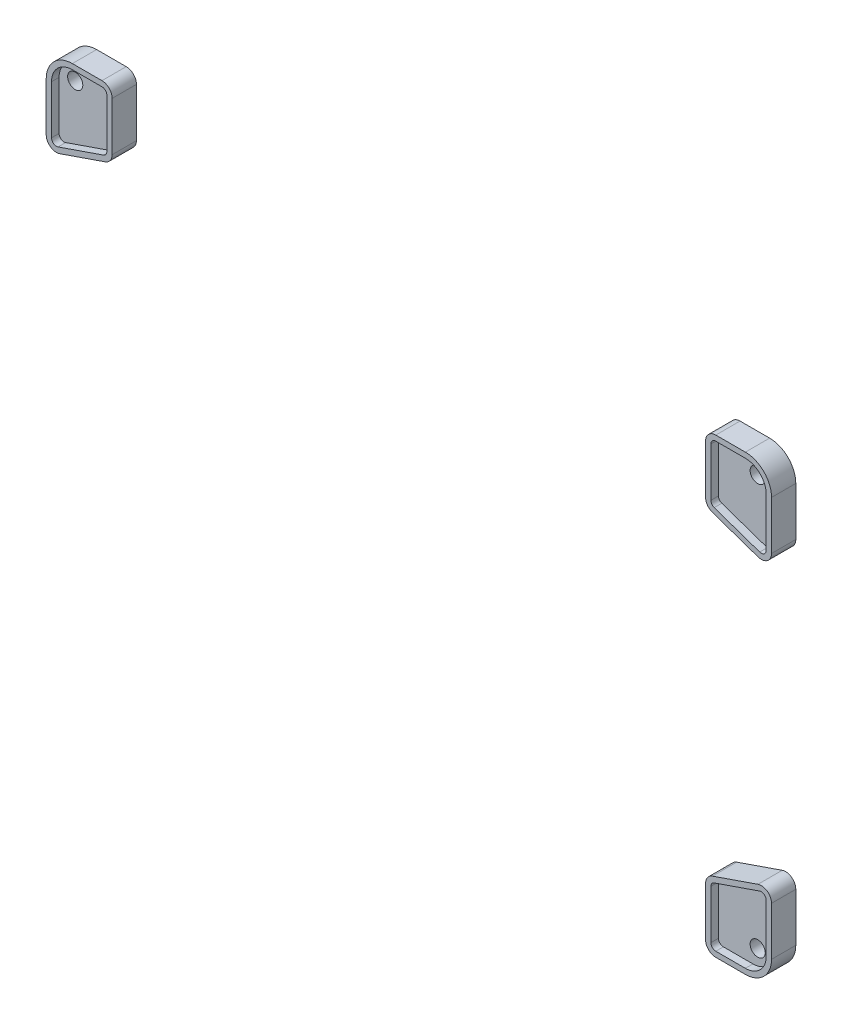
from build123d import *

# Parameters (mm, degrees)
BOSS_EXTRUDE1_DEPTH = 3.2
CUT_EXTRUDE1_DEPTH  = 1
SKETCH4_R           = 1
CUT_EXTRUDE2_DEPTH  = 57.453531776


with BuildPart() as part:
    # Sketch1 → Boss-Extrude1 (new body)
    with BuildSketch(Plane.XY):
        with BuildLine():
            Line((47.825, 19.975), (47.825, 26.375))
            ThreePointArc((47.825, 26.375), (46.814518395, 28.814518395), (44.375, 29.825))
            Line((44.375, 29.825), (40.475, 29.825))
            ThreePointArc((40.475, 29.825), (39.520405845, 29.429594155), (39.125, 28.475))
            Line((39.125, 28.475), (39.125, 22.044366415))
            ThreePointArc((39.125, 22.044366415), (39.375745502, 21.260695854), (40.034836368, 20.768139171))
            Line((40.034836368, 20.768139171), (46.034836368, 18.698772757))
            ThreePointArc((46.034836368, 18.698772757), (47.258670561, 18.875745502), (47.825, 19.975))
        make_face()
    extrude(amount=BOSS_EXTRUDE1_DEPTH)

    # Sketch2 → Cut-Extrude1 (cut)
    with BuildSketch(Plane.XY.offset(3.2)):
        with BuildLine():
            Line((40.263069362, 21.429886631), (46.263069362, 19.360520216))
            ThreePointArc((46.263069362, 19.360520216), (46.852322863, 19.445729316), (47.125, 19.975))
            Line((47.125, 19.975), (47.125, 26.375))
            ThreePointArc((47.125, 26.375), (46.319543648, 28.319543648), (44.375, 29.125))
            Line((44.375, 29.125), (40.475, 29.125))
            ThreePointArc((40.475, 29.125), (40.015380592, 28.934619408), (39.825, 28.475))
            Line((39.825, 28.475), (39.825, 22.044366415))
            ThreePointArc((39.825, 22.044366415), (39.945729316, 21.667043552), (40.263069362, 21.429886631))
        make_face()
    extrude(amount=-CUT_EXTRUDE1_DEPTH, mode=Mode.SUBTRACT)

    # Sketch4 → Cut-Extrude2 (cut, through all)
    with BuildSketch(Plane(origin=(0, 0, 0), x_dir=(-1, 0, 0), z_dir=(0, 0, -1))):
        with Locations((-45, 27.04)):
            Circle(SKETCH4_R)
    extrude(amount=-CUT_EXTRUDE2_DEPTH, mode=Mode.SUBTRACT)


with BuildPart() as body_2:
    # Mirror2: mirrored copy
    add(part.part.mirror(Plane.ZX))


with BuildPart() as body_3:
    # Mirror3: mirrored copy
    add(part.part.mirror(Plane(origin=(0, 0, 0), x_dir=(0, 0, 1), z_dir=(1, 0, 0))))


solid = Compound([part.part, body_2.part, body_3.part])
